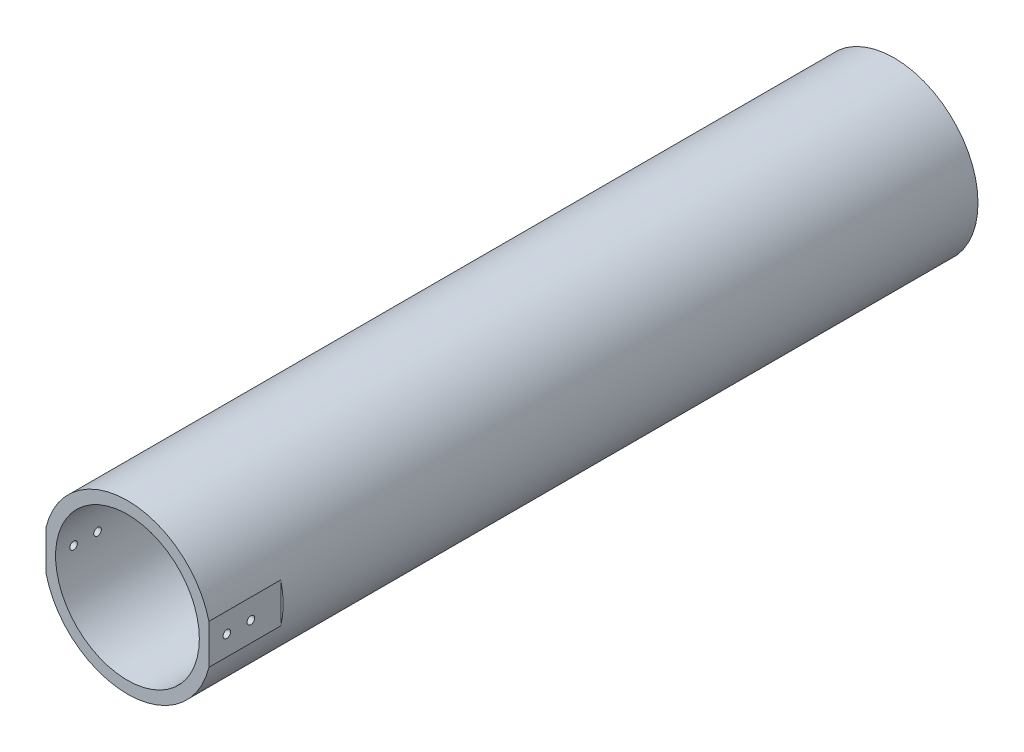
from build123d import *

# Parameters (mm, degrees)
SKETCH1_R                       = 44.45
SKETCH1_R_2                     = 38.1
BOSS_EXTRUDE1_DEPTH             = 203.2
SKETCH2_W                       = 7.89975339
SKETCH2_H                       = 28.462346772
CUT_EXTRUDE1_DEPTH              = 38.1
F_10_32_TAPPED_HOLE1_AT_2_COUNT = 2
F_10_32_TAPPED_HOLE1_AT_2_PITCH = 12.7
F_8_32_TAPPED_HOLE1_D           = 3.4544
F_8_32_TAPPED_HOLE1_DEPTH       = 14.986
F_8_32_TAPPED_HOLE1_TIP         = 1.037806461


with BuildPart() as part:
    # Sketch1 → Boss-Extrude1 (new, symmetric)
    with BuildSketch(Plane.XY):
        Circle(SKETCH1_R)
        Circle(SKETCH1_R_2, mode=Mode.SUBTRACT)
    extrude(amount=BOSS_EXTRUDE1_DEPTH, both=True)

    # Sketch2 → Cut-Extrude1 (cut)
    with BuildSketch(Plane.XY.offset(203.2)):
        with Locations((47.129876695, -0.406604954)):
            Rectangle(SKETCH2_W, SKETCH2_H)
    cut_extrude1 = extrude(amount=-CUT_EXTRUDE1_DEPTH, mode=Mode.SUBTRACT)

    # Sketch3 → #10-32 Tapped Hole1 (revolve, cut)
    with BuildSketch(Plane(origin=(43.18, 0, 193.675), x_dir=(0, 0, -1), z_dir=(0, 1, 0))):
        Polygon((0, 0), (0, 14.929317848), (2.0193, 13.716), (2.0193, 0), align=None)
    f_10_32_tapped_hole1 = revolve(axis=Axis((49.53, 0, 193.675), (-1, 0, 0)), mode=Mode.SUBTRACT)

    # #10-32 Tapped Hole1 at 2: #10-32 Tapped Hole1 ×2
    with Locations(*[(0, 0, -i * F_10_32_TAPPED_HOLE1_AT_2_PITCH) for i in range(1, F_10_32_TAPPED_HOLE1_AT_2_COUNT)]):
        add(f_10_32_tapped_hole1, mode=Mode.SUBTRACT)

    # #8-32 Tapped Hole1
    with Locations(Plane(origin=(0, 0, -203.2), x_dir=(-1, 0, 0), z_dir=(0, 0, -1))):
        with Locations((0, 41.275), (-41.275, 0), (41.275, 0), (0, -41.275)):
            Hole(F_8_32_TAPPED_HOLE1_D / 2, depth=F_8_32_TAPPED_HOLE1_DEPTH)
            with Locations((0, 0, -(F_8_32_TAPPED_HOLE1_DEPTH + F_8_32_TAPPED_HOLE1_TIP / 2))):  # 118° drill point
                Cone(0, F_8_32_TAPPED_HOLE1_D / 2, F_8_32_TAPPED_HOLE1_TIP, mode=Mode.SUBTRACT)

    # Mirror1: Cut-Extrude1, #10-32 Tapped Hole1 across plane
    add(cut_extrude1.mirror(Plane(origin=(0, 0, 0), x_dir=(0, 0, 1), z_dir=(1, 0, 0))), mode=Mode.SUBTRACT)
    add(f_10_32_tapped_hole1.mirror(Plane(origin=(0, 0, 0), x_dir=(0, 0, 1), z_dir=(1, 0, 0))), mode=Mode.SUBTRACT)

    # Mirror1 copy 1 sketch → Mirror1 copy 1 (revolve, cut)
    with BuildSketch(Plane(origin=(-43.18, 0, 180.975), x_dir=(0, 0, -1), z_dir=(0, 1, 0))):
        Polygon((0, 0), (0, -14.929317848), (2.0193, -13.716), (2.0193, 0), align=None)
    revolve(axis=Axis((-49.53, 0, 180.975), (-1, 0, 0)), mode=Mode.SUBTRACT)


solid = part.part
